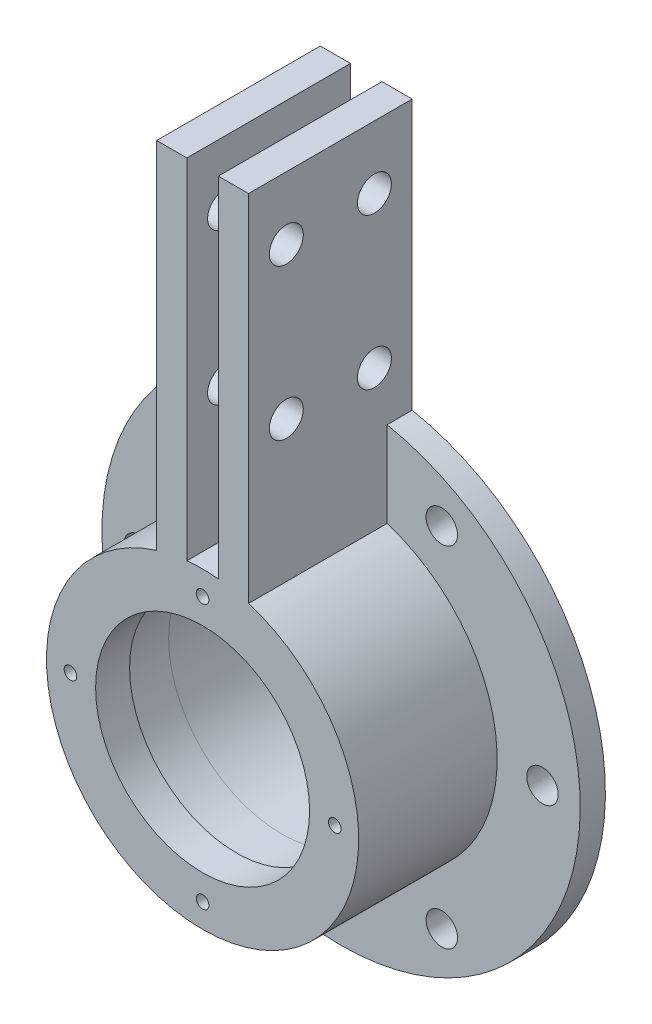
from build123d import *

# Parameters (mm, degrees)
SKETCH1_R              = 42.5
BOSS_EXTRUDE1_DEPTH    = 65
SKETCH2_R              = 42.5
BOSS_EXTRUDE2_DEPTH    = 10
SKETCH3_R              = 45.05
CUT_EXTRUDE1_DEPTH     = 33.5
SKETCH4_R              = 44.9925
CUT_EXTRUDE2_DEPTH     = 18
F_12_0MM_DOWEL_HOLE1_D = 12.5
M6_TAPPED_HOLE1_D      = 5
M6_TAPPED_HOLE1_DEPTH  = 12
M6_TAPPED_HOLE1_TIP    = 1.502151548
BOSS_EXTRUDE3_START    = 5
SKETCH10_R             = 52.5
SKETCH10_R_2           = 45.05
BOSS_EXTRUDE3_DEPTH    = 5
F_12_0MM_DOWEL_HOLE2_D = 13.5


with BuildPart() as part:
    # Sketch1 → Boss-Extrude1 (new body)
    with BuildSketch(Plane.XY):
        with BuildLine():
            Line((-18.25, 59.253164472), (-18.25, 200.253164472))
            Line((-18.25, 200.253164472), (-6.25, 200.253164472))
            Line((-6.25, 200.253164472), (-6.25, 61.684175442))
            ThreePointArc((-6.25, 61.684175442), (0, 62), (6.25, 61.684175442))
            Line((6.25, 61.684175442), (6.25, 200.253164472))
            Line((6.25, 200.253164472), (18.25, 200.253164472))
            Line((18.25, 200.253164472), (18.25, 59.253164472))
            ThreePointArc((18.25, 59.253164472), (0, -62), (-18.25, 59.253164472))
        make_face()
        Circle(SKETCH1_R, mode=Mode.SUBTRACT)
    extrude(amount=BOSS_EXTRUDE1_DEPTH)

    # Sketch2 → Boss-Extrude2 (add)
    # profile 1 of 2: a face of its own
    with BuildSketch(Plane(origin=(0, 0, 0), x_dir=(-1, 0, 0), z_dir=(0, 0, -1))):
        with BuildLine():
            ThreePointArc((-18.25, 93.230560977), (0, -95), (18.25, 93.230560977))
            Line((18.25, 93.230560977), (18.25, 59.253164472))
            ThreePointArc((18.25, 59.253164472), (0, -62), (-18.25, 59.253164472))
            Line((-18.25, 59.253164472), (-18.25, 93.230560977))
        make_face()
    # profile 2 of 2: a face of its own
    with BuildSketch(Plane(origin=(0, 0, 0), x_dir=(-1, 0, 0), z_dir=(0, 0, -1))):
        with BuildLine():
            ThreePointArc((18.25, 93.230560977), (12.27492281, 94.203642552), (6.25, 94.794184948))
            Line((6.25, 94.794184948), (6.25, 61.684175442))
            ThreePointArc((6.25, 61.684175442), (0, 62), (-6.25, 61.684175442))
            Line((-6.25, 61.684175442), (-6.25, 94.794184948))
            ThreePointArc((-6.25, 94.794184948), (-12.27492281, 94.203642552), (-18.25, 93.230560977))
            Line((-18.25, 93.230560977), (-18.25, 59.253164472))
            ThreePointArc((-18.25, 59.253164472), (0, -62), (18.25, 59.253164472))
            Line((18.25, 59.253164472), (18.25, 93.230560977))
        make_face()
        with Locations(Location((0, 0, 0), (0, 0, 180))):
            Circle(SKETCH2_R, mode=Mode.SUBTRACT)
    extrude(amount=-BOSS_EXTRUDE2_DEPTH)

    # Sketch3 → Cut-Extrude1 (cut)
    with BuildSketch(Plane(origin=(0, 0, 0), x_dir=(-1, 0, 0), z_dir=(0, 0, -1))):
        Circle(SKETCH3_R)
    extrude(amount=-CUT_EXTRUDE1_DEPTH, mode=Mode.SUBTRACT)

    # Sketch4 → Cut-Extrude2 (cut)
    with BuildSketch(Plane(origin=(0, 0, 33.5), x_dir=(-1, 0, 0), z_dir=(0, 0, -1))):
        Circle(SKETCH4_R)
    extrude(amount=-CUT_EXTRUDE2_DEPTH, mode=Mode.SUBTRACT)

    # Ø12.0mm Dowel Hole1 (through all)
    with Locations(Plane(origin=(0, 0, 0), x_dir=(-1, 0, 0), z_dir=(0, 0, -1))):
        with Locations((-40, -69.282032303), (-80, 0), (-40, 69.282032303), (40, 69.282032303), (80, 0), (40, -69.282032303)):
            Hole(F_12_0MM_DOWEL_HOLE1_D / 2)

    # M6 Tapped Hole1
    with Locations(Plane.XY.offset(65)):
        with Locations((0, -52.5), (-52.5, 0), (0, 52.5), (52.5, 0)):
            Hole(M6_TAPPED_HOLE1_D / 2, depth=M6_TAPPED_HOLE1_DEPTH)
            with Locations((0, 0, -(M6_TAPPED_HOLE1_DEPTH + M6_TAPPED_HOLE1_TIP / 2))):  # 118° drill point
                Cone(0, M6_TAPPED_HOLE1_D / 2, M6_TAPPED_HOLE1_TIP, mode=Mode.SUBTRACT)

    # Sketch10 → Boss-Extrude3 (add)
    with BuildSketch(Plane(origin=(0, 0, 0), x_dir=(-1, 0, 0), z_dir=(0, 0, -1)).offset(BOSS_EXTRUDE3_START)):
        with Locations(Location((0, 0, 0), (0, 0, 180))):
            Circle(SKETCH10_R)
        Circle(SKETCH10_R_2, mode=Mode.SUBTRACT)
    extrude(amount=-BOSS_EXTRUDE3_DEPTH)

    # Ø12.0mm Dowel Hole2 (through all)
    with Locations(Plane.ZY.offset(18.25)):
        with Locations((15, 175.253164472), (50, 175.253164472), (50, 115.253164472), (15, 115.253164472)):
            Hole(F_12_0MM_DOWEL_HOLE2_D / 2)


solid = part.part
